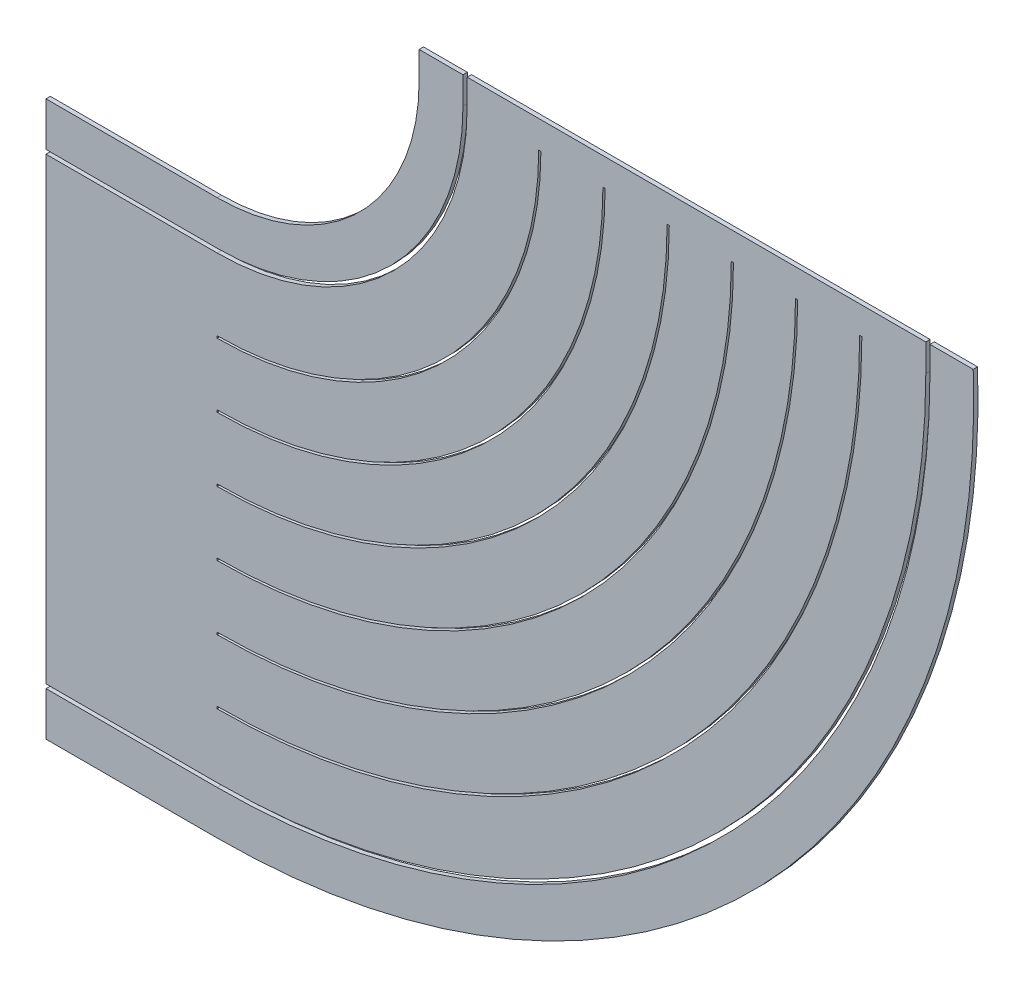
from build123d import *

# Parameters (mm, degrees)
BOSS_EXTRUDE1_DEPTH   = 6.35
BOSS_EXTRUDE1_2_DEPTH = 6.35
BOSS_EXTRUDE1_3_DEPTH = 6.35


with BuildPart() as part:
    # Sketch1 → Boss-Extrude1 (new body)
    with BuildSketch(Plane.XY):
        with BuildLine():
            Line((1559, -4410), (1495, -4410))
            Line((1495, -4410), (1495, -4450))
            ThreePointArc((1495, -4450), (1408.59650045, -4658.59650045), (1200, -4745))
            Line((1200, -4745), (950, -4745))
            Line((950, -4745), (950, -4809))
            Line((950, -4809), (1200, -4809))
            ThreePointArc((1200, -4809), (1453.851334446, -4703.851334446), (1559, -4450))
            Line((1559, -4450), (1559, -4410))
        make_face()
    extrude(amount=BOSS_EXTRUDE1_DEPTH)


with BuildPart() as body_2:
    # Sketch1 → Boss-Extrude1 2 (new body)
    with BuildSketch(Plane.XY):
        with BuildLine():
            Line((2235, -4410), (1565, -4410))
            Line((1565, -4410), (1565, -4450))
            ThreePointArc((1565, -4450), (1458.093975133, -4708.093975133), (1200, -4815))
            Line((1200, -4815), (950, -4815))
            Line((950, -4815), (950, -5485))
            Line((950, -5485), (1200, -5485))
            ThreePointArc((1200, -5485), (1931.855518528, -5181.855518528), (2235, -4450))
            Line((2235, -4450), (2235, -4410))
        make_face()
        with BuildLine():
            ThreePointArc((1200, -5388.4), (1863.549003465, -5113.549003465), (2138.4, -4450))
            Line((2138.4, -4450), (2141.6, -4450))
            ThreePointArc((2141.6, -4450), (1865.811745165, -5115.811745165), (1200, -5391.6))
            Line((1200, -5391.6), (1200, -5388.4))
        make_face(mode=Mode.SUBTRACT)
        with BuildLine():
            Line((1200, -5297.85), (1200, -5294.65))
            ThreePointArc((1200, -5294.65), (1797.257742729, -5047.257742729), (2044.65, -4450))
            Line((2044.65, -4450), (2047.85, -4450))
            ThreePointArc((2047.85, -4450), (1799.520484429, -5049.520484429), (1200, -5297.85))
        make_face(mode=Mode.SUBTRACT)
        with BuildLine():
            Line((1950.9, -4450), (1954.1, -4450))
            ThreePointArc((1954.1, -4450), (1733.229223693, -4983.229223693), (1200, -5204.1))
            Line((1200, -5204.1), (1200, -5200.9))
            ThreePointArc((1200, -5200.9), (1730.966481993, -4980.966481993), (1950.9, -4450))
        make_face(mode=Mode.SUBTRACT)
        with BuildLine():
            Line((1857.15, -4450), (1860.35, -4450))
            ThreePointArc((1860.35, -4450), (1666.937962957, -4916.937962957), (1200, -5110.35))
            Line((1200, -5110.35), (1200, -5107.15))
            ThreePointArc((1200, -5107.15), (1664.675221257, -4914.675221257), (1857.15, -4450))
        make_face(mode=Mode.SUBTRACT)
        with BuildLine():
            Line((1763.4, -4450), (1766.6, -4450))
            ThreePointArc((1766.6, -4450), (1600.64670222, -4850.64670222), (1200, -5016.6))
            Line((1200, -5016.6), (1200, -5013.4))
            ThreePointArc((1200, -5013.4), (1598.383960521, -4848.383960521), (1763.4, -4450))
        make_face(mode=Mode.SUBTRACT)
        with BuildLine():
            Line((1669.65, -4450), (1672.85, -4450))
            ThreePointArc((1672.85, -4450), (1534.355441484, -4784.355441484), (1200, -4922.85))
            Line((1200, -4922.85), (1200, -4919.65))
            ThreePointArc((1200, -4919.65), (1532.092699784, -4782.092699784), (1669.65, -4450))
        make_face(mode=Mode.SUBTRACT)
    extrude(amount=BOSS_EXTRUDE1_2_DEPTH)


with BuildPart() as body_3:
    # Sketch1 → Boss-Extrude1 3 (new body)
    with BuildSketch(Plane.XY):
        with BuildLine():
            Line((2304.275780772, -4410), (2241, -4410))
            Line((2241, -4410), (2241, -4450))
            ThreePointArc((2241, -4450), (1936.098159215, -5186.098159215), (1200, -5491))
            Line((1200, -5491), (950, -5491))
            Line((950, -5491), (950, -5555))
            Line((950, -5555), (1200, -5555))
            ThreePointArc((1200, -5555), (1995.369411029, -5217.08050425), (2304.275780772, -4410))
        make_face()
    extrude(amount=BOSS_EXTRUDE1_3_DEPTH)


solid = Compound([part.part, body_2.part, body_3.part])
